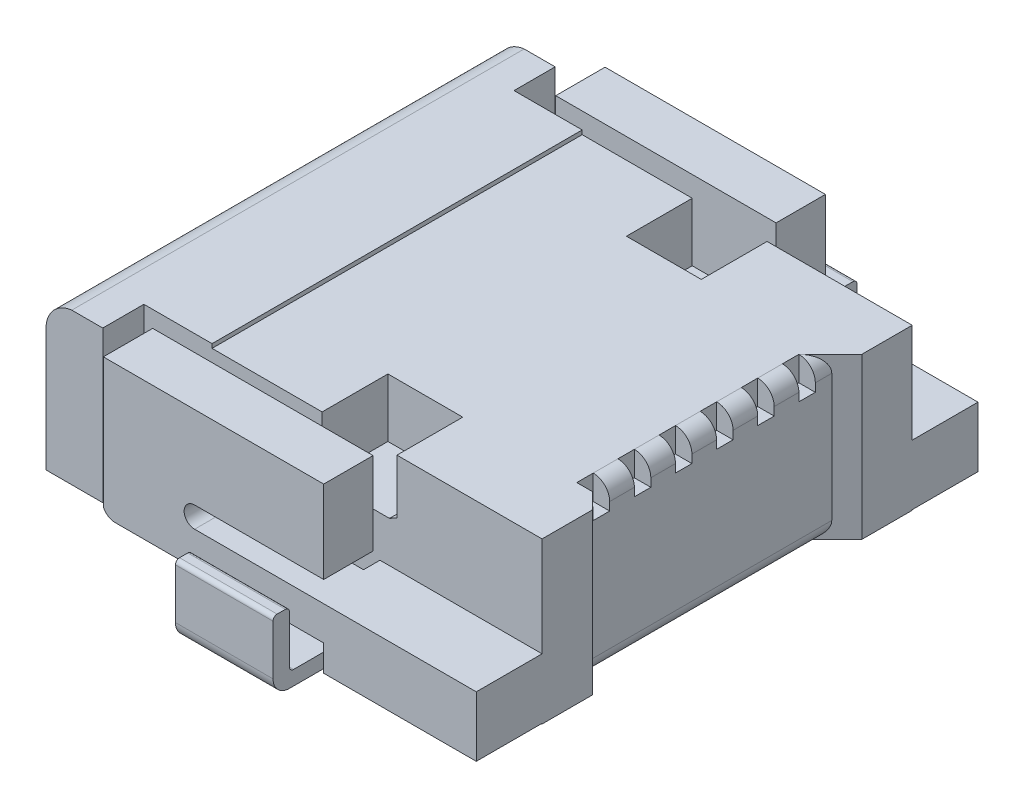
from build123d import *

# Parameters (mm, degrees)
BOSS_EXTRUDE1_DEPTH  = 0.6
BOSS_EXTRUDE2_DEPTH  = 0.8
SKETCH8_W            = 1.187106534
SKETCH8_H            = 0.413578876
BOSS_EXTRUDE3_DEPTH  = 0.6
BOSS_EXTRUDE5_DEPTH  = 1.999195913
CUT_EXTRUDE6_DEPTH   = 0.8
SKETCH19_W           = 2.25
SKETCH19_H           = 1.999195913
BOSS_EXTRUDE6_DEPTH  = 0.963004
BOSS_EXTRUDE7_DEPTH  = 2.25
CUT_EXTRUDE7_DEPTH   = 2.25
BOSS_EXTRUDE8_DEPTH  = 0.5
CUT_EXTRUDE8_DEPTH   = 0.05
FILLET4_R            = 0.2
BOSS_EXTRUDE9_DEPTH  = 0.5
SKETCH27_W           = 1.187106534
SKETCH27_H           = 0.682337146
BOSS_EXTRUDE10_DEPTH = 0.2
FILLET6_R            = 0.2
FILLET7_R            = 0.05
BOSS_EXTRUDE11_DEPTH = 1.187106534
FILLET6_OF_MIRROR6_R = 0.2
FILLET7_OF_MIRROR6_R = 0.05
FILLET8_R            = 0.05
FILLET9_R            = 0.05
SKETCH29_W           = 0.671445733
SKETCH29_H           = 0.2
CUT_EXTRUDE9_DEPTH   = 0.3
CUT_EXTRUDE10_DEPTH  = 0.68797799
SKETCH31_W           = 0.2
SKETCH31_H           = 0.54
BOSS_EXTRUDE12_DEPTH = 0.05
SKETCH32_W           = 0.2
SKETCH32_H           = 0.1602235
BOSS_EXTRUDE13_DEPTH = 0.01
LPATTERN1_COUNT      = 6
LPATTERN1_PITCH      = 0.5


with BuildPart() as part:
    # Sketch5 → Boss-Extrude1 (new body)
    with BuildSketch(Plane.XY):
        with BuildLine():
            Line((1.03647469, 0.909619652), (1.03647469, 0.476981472))
            add(Edge.make_bspline(
                [(1.184733339, 0.385802819), (1.081992039, 0.388557453), (1.03647469, 0.476981472)],
                knots=[0, 0, 0, 1, 1, 1], degree=2))
            Line((1.184733339, 0.385802819), (2.412634415, 0.385802819))
            Line((2.412634415, 0.385802819), (2.412634415, 0.799381695))
            Line((2.412634415, 0.799381695), (2.14625929, 0.799381695))
            ThreePointArc((2.14625929, 0.799381695), (2.018862492, 0.926778494), (2.14625929, 1.054175292))
            Line((2.14625929, 1.054175292), (3.715556221, 1.054175292))
            Line((3.715556221, 1.054175292), (3.715556221, 1.297888432))
            Line((3.715556221, 1.297888432), (3.715556221, 2.059195913))
            Line((3.715556221, 2.059195913), (1.03647469, 2.059195913))
            Line((1.03647469, 2.059195913), (1.03647469, 1.21340623))
            Line((1.03647469, 1.21340623), (1.03647469, 0.909619652))
        make_face()
    boss_extrude1 = extrude(amount=-BOSS_EXTRUDE1_DEPTH)



with BuildPart() as body_2:
    # Sketch7 → Boss-Extrude2 (new body)
    with BuildSketch(Plane.XY):
        Polygon((3.715556221, 0.067073076), (5.570517707, 0.067073076), (5.570517707, 0.174952185), (5.570517707, 0.799381695), (3.599740949, 0.799381695), (3.599740949, 0.385802819), (3.715556221, 0.385802819), (3.715556221, 0.174952185), align=None)
    boss_extrude2 = extrude(amount=-BOSS_EXTRUDE2_DEPTH)


with BuildPart() as part_1:
    add(part.part)

    add(body_2.part)  # Boss-Extrude3 merges body 2
    # Sketch8 → Boss-Extrude3 (add)
    with BuildSketch(Plane.XY):
        with Locations((3.006187682, 0.592592257)):
            Rectangle(SKETCH8_W, SKETCH8_H)
    boss_extrude3 = extrude(amount=-BOSS_EXTRUDE3_DEPTH)

    # Sketch13 → Boss-Extrude5 (add)
    with BuildSketch(Plane(origin=(0, 0.06, 0), x_dir=(1, 0, 0), z_dir=(0, 1, 0))):
        Polygon((5.307650665, 3.05), (1.692449276, 3.05), (1.692449276, 0.8), (5.570517707, 0.8), (5.570517707, 1.413103506), (5.3880831, 1.595538113), (5.3880831, 3.05), align=None)
    boss_extrude5 = extrude(amount=BOSS_EXTRUDE5_DEPTH)

    # Sketch17 → Cut-Extrude6 (cut)
    with BuildSketch(Plane.XY.offset(-0.8)):
        Polygon((3.806395908, 1.34820616), (3.715556221, 1.297888432), (2.896280475, 1.297888432), (2.896280475, 2.059195913), (3.806395908, 2.059195913), align=None)
    cut_extrude6 = extrude(amount=-CUT_EXTRUDE6_DEPTH, mode=Mode.SUBTRACT)



with BuildPart() as body_2_2:
    # Sketch19 → Boss-Extrude6 (new body)
    with BuildSketch(Plane.ZY.offset(-1.692449276)):
        with Locations((-1.925, 1.059597956)):
            Rectangle(SKETCH19_W, SKETCH19_H)
    boss_extrude6 = extrude(amount=BOSS_EXTRUDE6_DEPTH)

    # Sketch18 → Boss-Extrude7 (add)
    with BuildSketch(Plane.XY.offset(-0.8)):
        with BuildLine():
            Line((0.041467015, 1.670216776), (0.041467015, 0.219865316))
            Line((0.041467015, 0.219865316), (0.729445005, 0.219865316))
            Line((0.729445005, 0.219865316), (0.729445005, 0.909619652))
            Line((0.729445005, 0.909619652), (0.729445005, 2.059195913))
            Line((0.729445005, 2.059195913), (0.352729657, 2.059195913))
            ThreePointArc((0.352729657, 2.059195913), (0.116538119, 1.929170948), (0.041467015, 1.670216776))
        make_face()
    boss_extrude7 = extrude(amount=-BOSS_EXTRUDE7_DEPTH)

    # Sketch20 → Cut-Extrude7 (cut)
    with BuildSketch(Plane.XY.offset(-0.8)):
        Polygon((1.03647469, 0.067073076), (1.03647469, 0.909619652), (0.729445005, 0.909619652), (0.729445005, 0.219865316), (0.729445005, 0.06), (0.729445005, -0.020267982), (1.03647469, -0.020267982), align=None)
    cut_extrude7 = extrude(amount=-CUT_EXTRUDE7_DEPTH, mode=Mode.SUBTRACT)

    # Sketch21 → Boss-Extrude8 (add)
    with BuildSketch(Plane.XY.offset(-0.8)):
        with BuildLine():
            Line((0.729445005, 0.219865316), (0.729445005, 0.909619652))
            Line((0.729445005, 0.909619652), (0.729445005, 2.059195913))
            Line((0.729445005, 2.059195913), (0.352729657, 2.059195913))
            ThreePointArc((0.352729657, 2.059195913), (0.116538119, 1.929170948), (0.041467015, 1.670216776))
            Line((0.041467015, 1.670216776), (0.041467015, 0.219865316))
            Line((0.041467015, 0.219865316), (0.729445005, 0.219865316))
        make_face()
    boss_extrude8 = extrude(amount=BOSS_EXTRUDE8_DEPTH)


with BuildPart() as part_2:
    add(part_1.part)

    add(body_2_2.part)  # Mirror1 merges body 2 2
    # Mirror1: Boss-Extrude1, Boss-Extrude2, Boss-Extrude3, Boss-Extrude5 across Plane3
    add(boss_extrude1.mirror(Plane.XY.offset(-3.05)))
    add(boss_extrude2.mirror(Plane.XY.offset(-3.05)))
    add(boss_extrude3.mirror(Plane.XY.offset(-3.05)))
    add(boss_extrude5.mirror(Plane.XY.offset(-3.05)))

    # Mirror1 2: Cut-Extrude6 across Plane3
    add(cut_extrude6.mirror(Plane.XY.offset(-3.05)), mode=Mode.SUBTRACT)

    # Mirror1 3: Boss-Extrude6, Boss-Extrude7 across Plane3
    add(boss_extrude6.mirror(Plane.XY.offset(-3.05)))
    add(boss_extrude7.mirror(Plane.XY.offset(-3.05)))

    # Mirror1 4: Cut-Extrude7 across Plane3
    add(cut_extrude7.mirror(Plane.XY.offset(-3.05)), mode=Mode.SUBTRACT)

    # Mirror1 5: Boss-Extrude8 across Plane3
    add(boss_extrude8.mirror(Plane.XY.offset(-3.05)))

    # Sketch22 → Cut-Extrude8 (cut)
    with BuildSketch(Plane(origin=(0, 2.059195913, 0), x_dir=(1, 0, 0), z_dir=(0, 1, 0))):
        Polygon((2.896280475, 5.3), (1.558180163, 5.3), (1.558180163, 0.8), (2.896280475, 0.8), (2.896280475, 1.6), (3.806395908, 1.6), (3.806395908, 0.8), (5.570517707, 0.8), (5.570517707, 1.413103506), (5.3880831, 1.595538113), (5.3880831, 4.504461887), (5.570517707, 4.686896494), (5.570517707, 5.3), (3.806395908, 5.3), (3.806395908, 4.5), (2.896280475, 4.5), align=None)
    extrude(amount=-CUT_EXTRUDE8_DEPTH, mode=Mode.SUBTRACT)

    # Fillet4
    fillet4_edges = [part_2.edges().sort_by_distance(p)[0] for p in [
        (5.3880831, 0.06, -3.05),
        (5.3880831, 2.009195913, -3.05),
    ]]
    fillet(fillet4_edges, radius=FILLET4_R)



with BuildPart() as body_2_3:
    # Sketch26 → Boss-Extrude9 (new body)
    with BuildSketch(Plane.XY):
        Polygon((2.412634415, 0.174952185), (2.412634415, 0.067073076), (2.412634415, 0), (3.599740949, 0), (3.599740949, 0.067073076), (3.599740949, 0.174952185), align=None)
    boss_extrude9 = extrude(amount=BOSS_EXTRUDE9_DEPTH)

    # Sketch27 → Boss-Extrude10 (add)
    with BuildSketch(Plane.XY.offset(0.5)):
        with Locations((3.006187682, 0.516120758)):
            Rectangle(SKETCH27_W, SKETCH27_H)
    boss_extrude10 = extrude(amount=-BOSS_EXTRUDE10_DEPTH)

    # Fillet6
    fillet6_edges = [body_2_3.edges().sort_by_distance(p)[0] for p in [
        (3.006187682, 0, 0.5),
    ]]
    fillet(fillet6_edges, radius=FILLET6_R)

    # Fillet7
    fillet7_edges = [body_2_3.edges().sort_by_distance(p)[0] for p in [
        (3.006187682, 0.857289331, 0.3),
        (3.006187682, 0.857289331, 0.5),
    ]]
    fillet(fillet7_edges, radius=FILLET7_R)


with BuildPart() as part_3:
    add(part_2.part)

    add(body_2_3.part)  # Boss-Extrude11 merges body 2 3
    # Sketch28 → Boss-Extrude11 (add)
    with BuildSketch(Plane.ZY.offset(-2.412634415)):
        with BuildLine():
            Line((-0.8, 0.323306936), (-0.8, 0.139277214))
            ThreePointArc((-0.8, 0.139277214), (-0.690012763, 0.045403916), (-0.552725208, 0))
            Line((-0.552725208, 0), (0, 0))
            Line((0, 0), (0, 0.174952185))
            Line((0, 0.174952185), (-0.552725208, 0.174952185))
            ThreePointArc((-0.552725208, 0.174952185), (-0.689100625, 0.227898076), (-0.8, 0.323306936))
        make_face()
    boss_extrude11 = extrude(amount=-BOSS_EXTRUDE11_DEPTH)

    # Mirror6: Boss-Extrude9, Boss-Extrude10, Boss-Extrude11 across plane
    add(boss_extrude9.mirror(Plane.XY.offset(-3.05)))
    add(boss_extrude10.mirror(Plane.XY.offset(-3.05)))
    add(boss_extrude11.mirror(Plane.XY.offset(-3.05)))

    # Fillet6 of Mirror6
    fillet6_of_mirror6_edges = [part_3.edges().sort_by_distance(p)[0] for p in [
        (3.006187682, 0, -6.6),
    ]]
    fillet(fillet6_of_mirror6_edges, radius=FILLET6_OF_MIRROR6_R)

    # Fillet7 of Mirror6
    fillet7_of_mirror6_edges = [part_3.edges().sort_by_distance(p)[0] for p in [
        (3.006187682, 0.857289331, -6.4),
        (3.006187682, 0.857289331, -6.6),
    ]]
    fillet(fillet7_of_mirror6_edges, radius=FILLET7_OF_MIRROR6_R)

    # Fillet8
    fillet8_edges = [part_3.edges().sort_by_distance(p)[0] for p in [
        (3.006187682, 0.174952185, 0.3),
    ]]
    fillet(fillet8_edges, radius=FILLET8_R)

    # Fillet9
    fillet9_edges = [part_3.edges().sort_by_distance(p)[0] for p in [
        (3.006187682, 0.174952185, -6.4),
    ]]
    fillet(fillet9_edges, radius=FILLET9_R)

    # Sketch29 → Cut-Extrude9 (cut)
    with BuildSketch(Plane(origin=(0, 2.009195913, 0), x_dir=(1, 0, 0), z_dir=(0, 1, 0))):
        with Locations((5.523805967, 3.704461887)):
            Rectangle(SKETCH29_W, SKETCH29_H)
        with Locations((5.523805967, 4.204461887)):
            Rectangle(SKETCH29_W, SKETCH29_H)
        with Locations((5.523805967, 3.204461887)):
            Rectangle(SKETCH29_W, SKETCH29_H)
        with Locations((5.523805967, 2.704461887)):
            Rectangle(SKETCH29_W, SKETCH29_H)
        with Locations((5.523805967, 2.204461887)):
            Rectangle(SKETCH29_W, SKETCH29_H)
        with Locations((5.523805967, 1.704461887)):
            Rectangle(SKETCH29_W, SKETCH29_H)
    extrude(amount=-CUT_EXTRUDE9_DEPTH, mode=Mode.SUBTRACT)

    # Sketch30 → Cut-Extrude10 (cut)
    with BuildSketch(Plane.ZY.offset(-0.041467015)):
        Polygon((-4.835, 0.219865316), (-4.835, 0.909619652), (-4.335, 0.909619652), (-4.335, 1.229619652), (-1.765, 1.229619652), (-1.765, 0.909619652), (-1.265, 0.909619652), (-1.265, 0.219865316), align=None)
    extrude(amount=-CUT_EXTRUDE10_DEPTH, mode=Mode.SUBTRACT)

    # Sketch31 → Boss-Extrude12 (add)
    with BuildSketch(Plane.ZY.offset(-1.03647469)):
        with Locations((-4.285, 0.639619652)):
            Rectangle(SKETCH31_W, SKETCH31_H)
        with Locations((-3.785, 0.639619652)):
            Rectangle(SKETCH31_W, SKETCH31_H)
        with Locations((-3.285, 0.639619652)):
            Rectangle(SKETCH31_W, SKETCH31_H)
        with Locations((-2.785, 0.639619652)):
            Rectangle(SKETCH31_W, SKETCH31_H)
        with Locations((-2.285, 0.639619652)):
            Rectangle(SKETCH31_W, SKETCH31_H)
        with Locations((-1.785, 0.639619652)):
            Rectangle(SKETCH31_W, SKETCH31_H)
    extrude(amount=BOSS_EXTRUDE12_DEPTH)

    # Sketch32 → Boss-Extrude13 (add)
    with BuildSketch(Plane.ZY.offset(-0.98647469)):
        with Locations((-4.285, 0.719731402)):
            Rectangle(SKETCH32_W, SKETCH32_H)
    boss_extrude13 = extrude(amount=BOSS_EXTRUDE13_DEPTH)

    # LPattern1: Boss-Extrude13 ×6
    with Locations(*[(0, 0, i * LPATTERN1_PITCH) for i in range(1, LPATTERN1_COUNT)]):
        add(boss_extrude13)


solid = part_3.part
